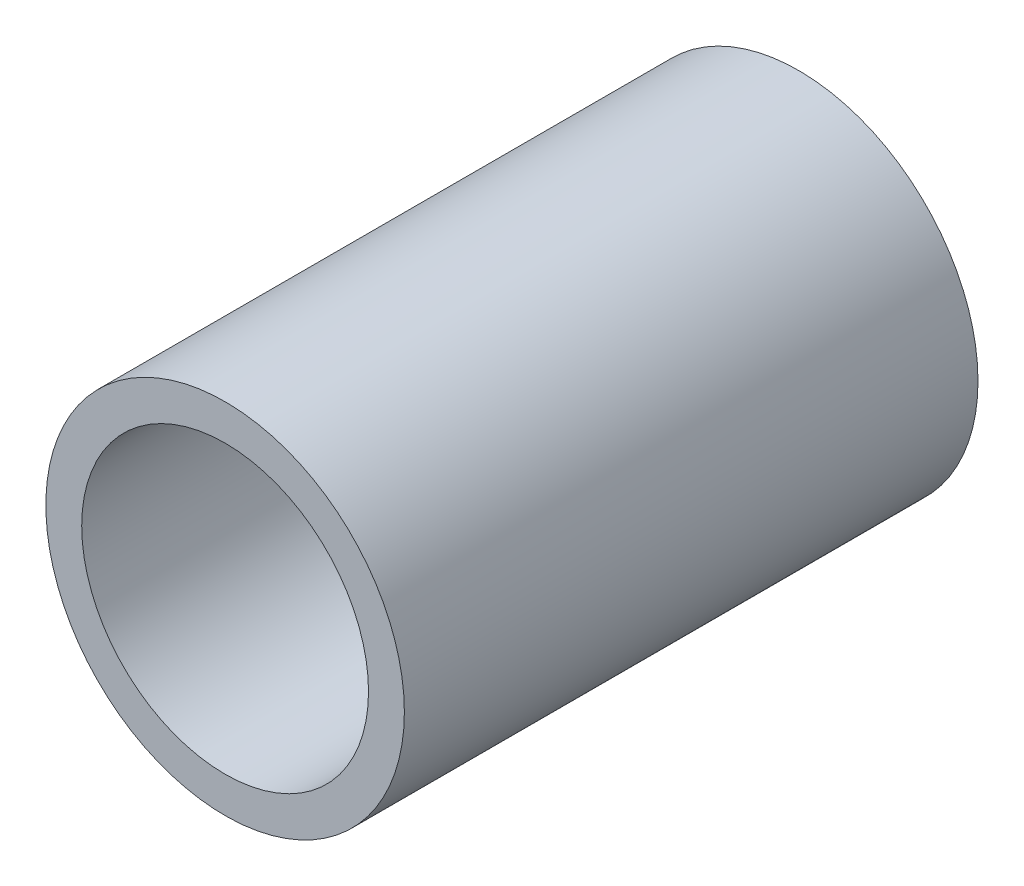
from build123d import *

# Parameters (mm, degrees)
SKETCH1_R      = 7.9375
SKETCH1_R_2    = 6.35
EXTRUDE1_DEPTH = 25.4


with BuildPart() as part:
    # Sketch1 → Extrude1 (new body)
    with BuildSketch(Plane.XY):
        Circle(SKETCH1_R)
        Circle(SKETCH1_R_2, mode=Mode.SUBTRACT)
    extrude(amount=EXTRUDE1_DEPTH)


solid = part.part
